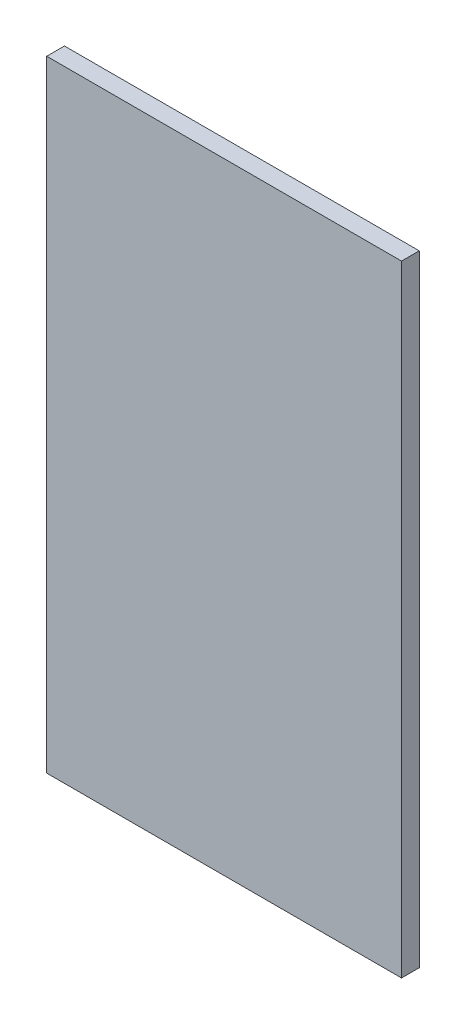
from build123d import *

# Parameters (mm, degrees)
SKETCH1_W           = 400
SKETCH1_H           = 700
BOSS_EXTRUDE1_DEPTH = 20


with BuildPart() as part:
    # Sketch1 → Boss-Extrude1 (new body)
    with BuildSketch(Plane.XY):
        with Locations((200, 350)):
            Rectangle(SKETCH1_W, SKETCH1_H)
    extrude(amount=BOSS_EXTRUDE1_DEPTH)


solid = part.part
